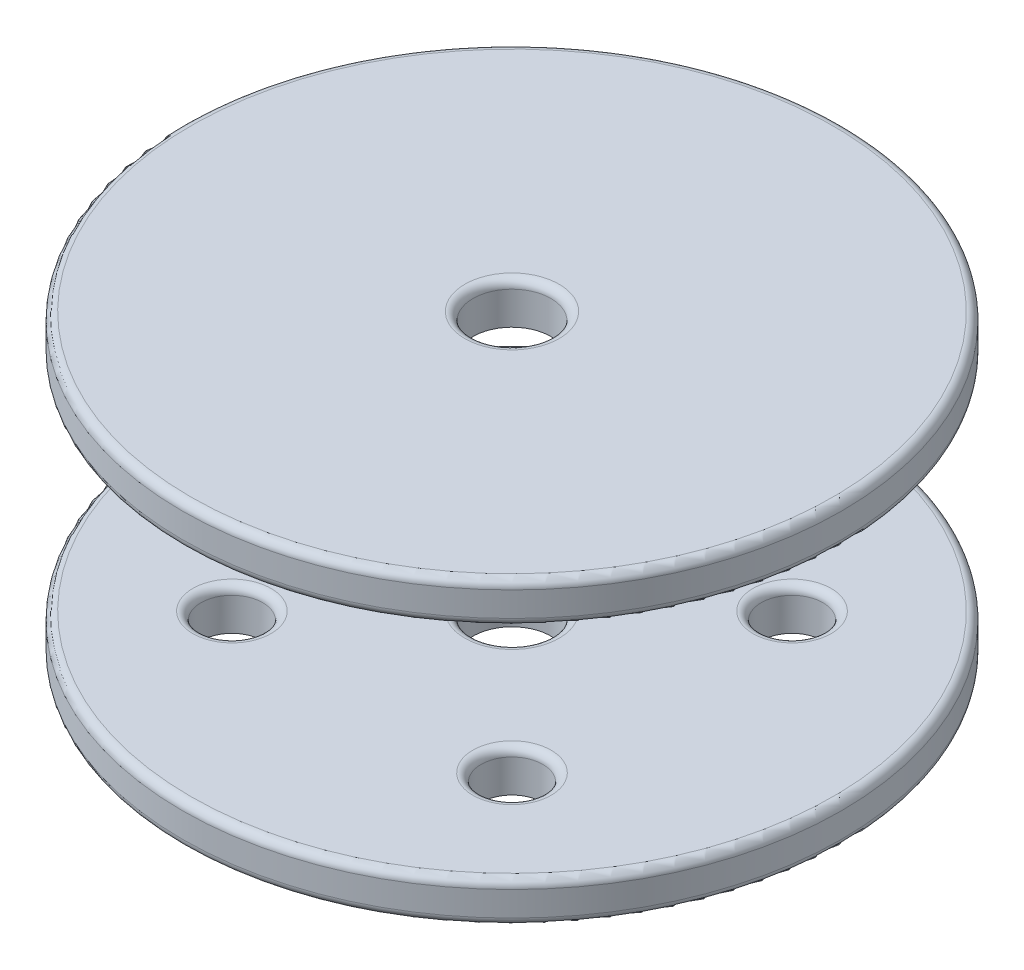
from build123d import *

# Parameters (mm, degrees)
SKETCH1_R           = 50.8
BOSS_EXTRUDE1_DEPTH = 6.35
SKETCH2_R           = 4.7625
SKETCH2_R_2         = 6
CUT_EXTRUDE1_DEPTH  = 6.35
FILLET1_R           = 1.27
SKETCH4_R           = 50.8
BOSS_EXTRUDE2_DEPTH = 6.35
CUT_EXTRUDE3_START  = 6.35
SKETCH5_R           = 6
CUT_EXTRUDE3_DEPTH  = 6.35
FILLET4_R           = 1.27
FILLET5_R           = 1.27
FILLET6_R           = 1.27
FILLET7_R           = 1.27
FILLET8_R           = 1.27
FILLET9_R           = 1.27


with BuildPart() as part:
    # Sketch1 → Boss-Extrude1 (new body)
    with BuildSketch(Plane(origin=(0, 0, 0), x_dir=(1, 0, 0), z_dir=(0, 1, 0))):
        with Locations(Location((0, 0, 0), (0, 0, 270))):
            Circle(SKETCH1_R)
    extrude(amount=BOSS_EXTRUDE1_DEPTH)

    # Sketch2 → Cut-Extrude1 (cut)
    with BuildSketch(Plane(origin=(0, 6.35, 0), x_dir=(1, 0, 0), z_dir=(0, 1, 0))):
        with Locations(Location((-21.59, 21.59, 0), (0, 0, 270))):
            Circle(SKETCH2_R)
        with Locations(Location((-21.59, -21.59, 0), (0, 0, 90))):
            Circle(SKETCH2_R)
        with Locations(Location((21.59, -21.59, 0), (0, 0, 270))):
            Circle(SKETCH2_R)
        with Locations(Location((21.59, 21.59, 0), (0, 0, 90))):
            Circle(SKETCH2_R)
        with Locations(Location((0, 0, 0), (0, 0, 270))):
            Circle(SKETCH2_R_2)
    extrude(amount=-CUT_EXTRUDE1_DEPTH, mode=Mode.SUBTRACT)

    # Fillet1
    fillet1_edges = [part.edges().sort_by_distance(p)[0] for p in [
        (21.59, 6.35, -16.8275),
        (21.59, 6.35, 16.8275),
        (-21.59, 6.35, 26.3525),
        (-21.59, 6.35, -26.3525),
    ]]
    fillet(fillet1_edges, radius=FILLET1_R)

    # Fillet7
    fillet7_edges = [part.edges().sort_by_distance(p)[0] for p in [
        (0, 6.35, -50.8),
    ]]
    fillet(fillet7_edges, radius=FILLET7_R)

    # Fillet8
    fillet8_edges = [part.edges().sort_by_distance(p)[0] for p in [
        (0, 0, -50.8),
    ]]
    fillet(fillet8_edges, radius=FILLET8_R)

    # Fillet9
    fillet9_edges = [part.edges().sort_by_distance(p)[0] for p in [
        (0, 6.35, -6),
    ]]
    fillet(fillet9_edges, radius=FILLET9_R)


with BuildPart() as body_2:
    # Sketch4 → Boss-Extrude2 (new body)
    with BuildSketch(Plane(origin=(0, 40.00000001, 0), x_dir=(1, 0, 0), z_dir=(0, 1, 0))):
        with Locations(Location((0, 0, 0), (0, 0, 270))):
            Circle(SKETCH4_R)
    extrude(amount=BOSS_EXTRUDE2_DEPTH)

    # Sketch5 → Cut-Extrude3 (cut)
    with BuildSketch(Plane(origin=(0, 40.00000001, 0), x_dir=(1, 0, 0), z_dir=(0, 1, 0)).offset(CUT_EXTRUDE3_START)):
        with Locations(Location((0, 0, 0), (0, 0, 270))):
            Circle(SKETCH5_R)
    extrude(amount=-CUT_EXTRUDE3_DEPTH, mode=Mode.SUBTRACT)

    # Fillet4
    fillet4_edges = [body_2.edges().sort_by_distance(p)[0] for p in [
        (0, 46.35000001, -6),
    ]]
    fillet(fillet4_edges, radius=FILLET4_R)

    # Fillet5
    fillet5_edges = [body_2.edges().sort_by_distance(p)[0] for p in [
        (0, 46.35000001, -50.8),
    ]]
    fillet(fillet5_edges, radius=FILLET5_R)

    # Fillet6
    fillet6_edges = [body_2.edges().sort_by_distance(p)[0] for p in [
        (0, 40.00000001, -50.8),
    ]]
    fillet(fillet6_edges, radius=FILLET6_R)


solid = Compound([part.part, body_2.part])
